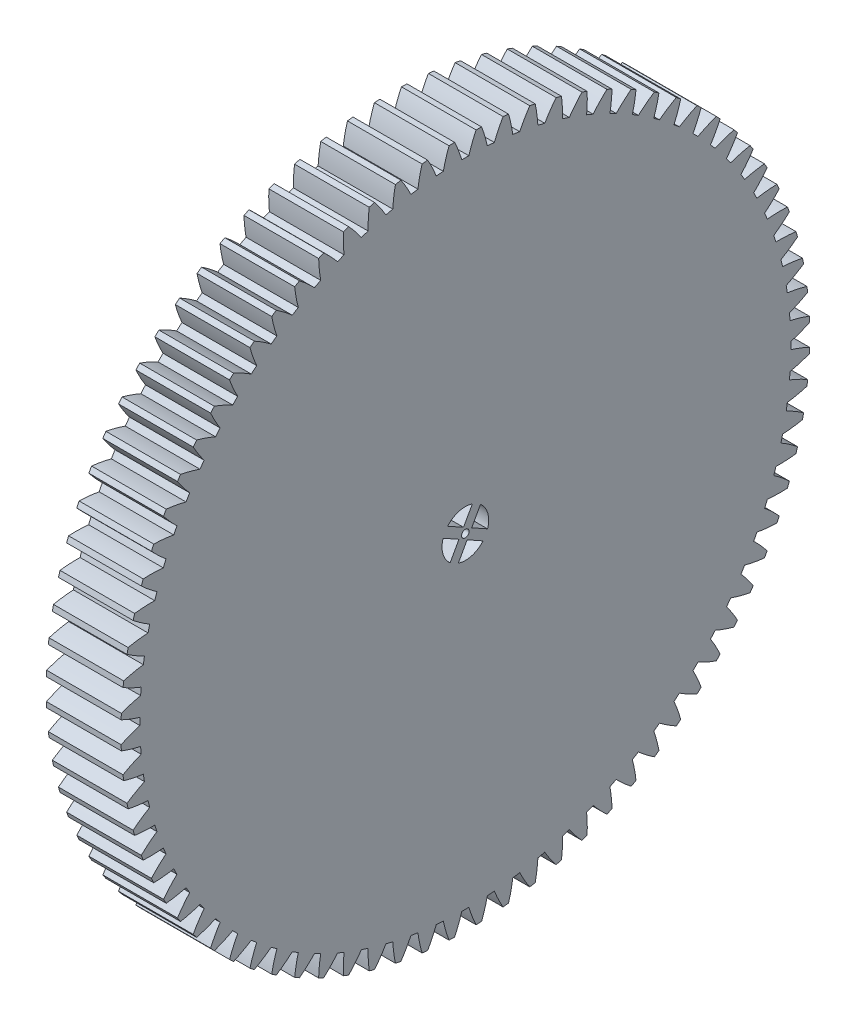
from build123d import *

# Parameters (mm, degrees)
BASPROSKE_W        = 8
BASPROSKE_H        = 36.9
TOOTHCUT_DEPTH     = 53.794128461
TEETHCUTS_COUNT    = 80
TEETHCUTS_ANGLE    = 355.5
BORSKE_R           = 0.4
BORE_DEPTH         = 50.0008636
CUT_EXTRUDE1_DEPTH = 8


with BuildPart() as part:
    # BasProSke → Base-Revolve (revolve)
    with BuildSketch(Plane(origin=(0, 0, 0), x_dir=(1, 0, 0), z_dir=(0, 1, 0)), mode=Mode.PRIVATE) as base_revolve_sk:
        with Locations((4, 18.45)):
            Rectangle(BASPROSKE_W, BASPROSKE_H)
    revolve(base_revolve_sk.sketch.rotate(Axis((-10, 0, 0), (1, 0, 0)), 180), axis=Axis((-10, 0, 0), (1, 0, 0)))

    # TooCutSke → ToothCut (cut, through all)
    with BuildSketch(Plane(origin=(0, 0, 0), x_dir=(0, 0, -1), z_dir=(1, 0, 0))):
        with BuildLine():
            ThreePointArc((0.378130829, 34.871949947), (0, 34.874), (-0.378130829, 34.871949947))
            ThreePointArc((-0.378130829, 34.871949947), (-0.732237129, 35.904400471), (-1.163527417, 36.907063946))
            ThreePointArc((-1.163527417, 36.907063946), (0, 36.9254), (1.163527417, 36.907063946))
            ThreePointArc((1.163527417, 36.907063946), (0.732237129, 35.904400471), (0.378130829, 34.871949947))
        make_face()
    toothcut = extrude(amount=TOOTHCUT_DEPTH, mode=Mode.SUBTRACT)

    # TeethCuts: ToothCut ×80 about axis
    teethcuts_axis = Axis((-10, 0, 0), (1, 0, 0))
    for i in range(1, TEETHCUTS_COUNT):
        add(toothcut.rotate(teethcuts_axis, i * TEETHCUTS_ANGLE / (TEETHCUTS_COUNT - 1)), mode=Mode.SUBTRACT)

    # BorSke → Bore (cut, symmetric)
    with BuildSketch(Plane(origin=(0, 0, 0), x_dir=(0, 0, -1), z_dir=(1, 0, 0))):
        with Locations(Location((0, 0, 0), (0, 0, 180))):
            Circle(BORSKE_R)
    extrude(amount=BORE_DEPTH, both=True, mode=Mode.SUBTRACT)

    # Sketch1 → Cut-Extrude1 (cut)
    with BuildSketch(Plane(origin=(8, 0, 0), x_dir=(0, 0, -1), z_dir=(1, 0, 0))):
        with BuildLine():
            ThreePointArc((0.755384304, 2.383148034), (-0.683892294, 2.404639543), (-1.896447215, 1.628953026))
            Line((-1.896447215, 1.628953026), (-0.193433951, 0.680134771))
            Line((-0.193433951, 0.680134771), (0.755384304, 2.383148034))
        make_face()
        with BuildLine():
            ThreePointArc((-2.383148034, 0.755384304), (-2.404639543, -0.683892294), (-1.628953026, -1.896447215))
            Line((-1.628953026, -1.896447215), (-0.680134771, -0.193433951))
            Line((-0.680134771, -0.193433951), (-2.383148034, 0.755384304))
        make_face()
        with BuildLine():
            Line((0.193433951, -0.680134771), (-0.755384304, -2.383148034))
            ThreePointArc((-0.755384304, -2.383148034), (0.683892294, -2.404639543), (1.896447215, -1.628953026))
            Line((1.896447215, -1.628953026), (0.193433951, -0.680134771))
        make_face()
        with BuildLine():
            Line((0.680134771, 0.193433951), (2.383148034, -0.755384304))
            ThreePointArc((2.383148034, -0.755384304), (2.470614305, -0.382184454), (2.5, 0))
            ThreePointArc((2.5, 0), (2.27182554, 1.043459974), (1.628953026, 1.896447215))
            Line((1.628953026, 1.896447215), (0.680134771, 0.193433951))
        make_face()
    extrude(amount=-CUT_EXTRUDE1_DEPTH, mode=Mode.SUBTRACT)


solid = part.part
